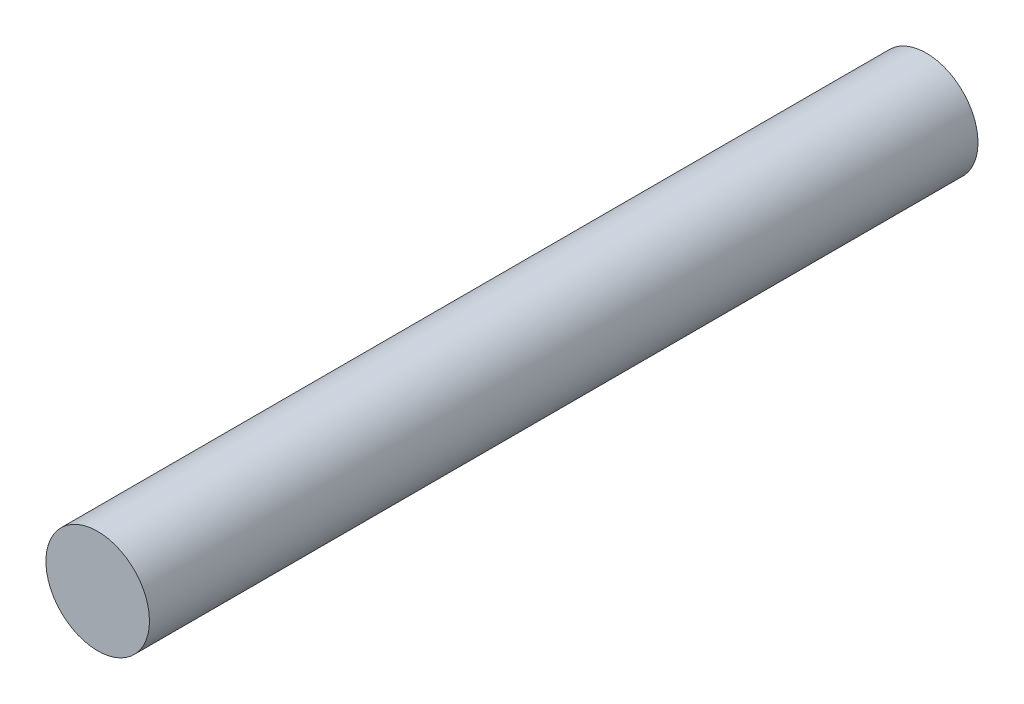
from build123d import *

# Parameters (mm, degrees)
SKETCH1_R           = 1.5875
BOSS_EXTRUDE1_DEPTH = 25.4


with BuildPart() as part:
    # Sketch1 → Boss-Extrude1 (new body)
    with BuildSketch(Plane(origin=(0, 0, 0), x_dir=(0, 1, 0), z_dir=(0, 0, 1))):
        with Locations(Location((0, 0, 0), (0, 0, 270))):
            Circle(SKETCH1_R)
    extrude(amount=BOSS_EXTRUDE1_DEPTH)


solid = part.part
